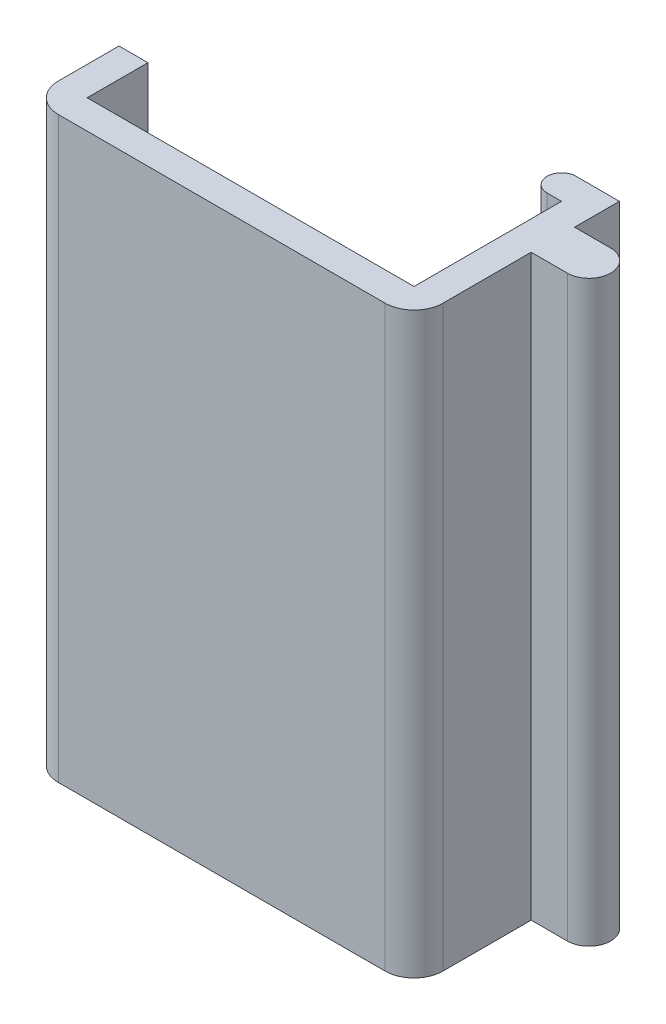
from build123d import *

# Parameters (mm, degrees)
SALIENTE_EXTRUIR1_DEPTH = 20
REDONDEO1_RADIUS        = 0.5
REDONDEO1_LENGTH        = 20
REDONDEO3_R             = 1
REDONDEO4_R             = 1
CROQUIS6_W              = 0.519230147
CROQUIS6_H              = 1.134138633
CORTAR_EXTRUIR2_DEPTH   = 31
CROQUIS7_W              = 1.5
CROQUIS7_H              = 20
SALIENTE_EXTRUIR2_DEPTH = 2
REDONDEO5_RADIUS        = 0.75
REDONDEO5_LENGTH        = 20


with BuildPart() as part:
    # Croquis3 → Saliente-Extruir1 (new body)
    with BuildSketch(Plane(origin=(0, 0, 0), x_dir=(1, 0, 0), z_dir=(0, 1, 0))):
        Polygon((-2.726281257, 0), (-4.017413973, 0), (-4.017413973, -3.1), (9.282586027, -3.1), (9.282586027, 4), (7.282586027, 4), (7.282586027, 3), (8.282586027, 3), (8.282586027, -2.1), (-3.017413973, -2.1), (-3.017413973, -1), (-2.726281257, -1), align=None)
    extrude(amount=SALIENTE_EXTRUIR1_DEPTH)

    # Redondeo1: full round fillet: the end face becomes a half cylinder, R = half its width
    redondeo1_face = Plane((7.282586027, 10, -3.5), x_dir=(0, 1, 0), z_dir=(-1, 0, 0))  # on the end face: x along it, z out of the body
    redondeo1_slab = redondeo1_face.offset(-REDONDEO1_RADIUS / 2) * Box(REDONDEO1_LENGTH, 2 * REDONDEO1_RADIUS, REDONDEO1_RADIUS, mode=Mode.PRIVATE)  # the body's end, R deep
    redondeo1_round = Plane((7.782586027, 10, -3.5), x_dir=(-1, 0, 0), z_dir=(0, 1, 0)) * Cylinder(REDONDEO1_RADIUS, REDONDEO1_LENGTH, mode=Mode.PRIVATE)  # its axis R under the face
    add(redondeo1_slab - redondeo1_round, mode=Mode.SUBTRACT)

    # Redondeo3
    redondeo3_edges = [part.edges().sort_by_distance(p)[0] for p in [
        (-4.017413973, 10, 3.1),
    ]]
    fillet(redondeo3_edges, radius=REDONDEO3_R)

    # Redondeo4
    redondeo4_edges = [part.edges().sort_by_distance(p)[0] for p in [
        (9.282586027, 10, 3.1),
    ]]
    fillet(redondeo4_edges, radius=REDONDEO4_R)

    # Croquis6 → Cortar-Extruir2 (cut)
    with BuildSketch(Plane(origin=(0, 20, 0), x_dir=(1, 0, 0), z_dir=(0, 1, 0))):
        with Locations((-2.7577989, -0.432930683)):
            Rectangle(CROQUIS6_W, CROQUIS6_H)
    extrude(amount=-CORTAR_EXTRUIR2_DEPTH, mode=Mode.SUBTRACT)

    # Croquis7 → Saliente-Extruir2 (add)
    with BuildSketch(Plane(origin=(9.282586027, 0, 0), x_dir=(0, 0, -1), z_dir=(1, 0, 0))):
        with Locations((1.7, 10)):
            Rectangle(CROQUIS7_W, CROQUIS7_H)
    extrude(amount=SALIENTE_EXTRUIR2_DEPTH)

    # Redondeo5: full round fillet: the end face becomes a half cylinder, R = half its width
    redondeo5_face = Plane((11.282586027, 10, -1.7), x_dir=(0, -1, 0), z_dir=(1, 0, 0))  # on the end face: x along it, z out of the body
    redondeo5_slab = redondeo5_face.offset(-REDONDEO5_RADIUS / 2) * Box(REDONDEO5_LENGTH, 2 * REDONDEO5_RADIUS, REDONDEO5_RADIUS, mode=Mode.PRIVATE)  # the body's end, R deep
    redondeo5_round = Plane((10.532586027, 10, -1.7), x_dir=(1, 0, 0), z_dir=(0, -1, 0)) * Cylinder(REDONDEO5_RADIUS, REDONDEO5_LENGTH, mode=Mode.PRIVATE)  # its axis R under the face
    add(redondeo5_slab - redondeo5_round, mode=Mode.SUBTRACT)


solid = part.part
